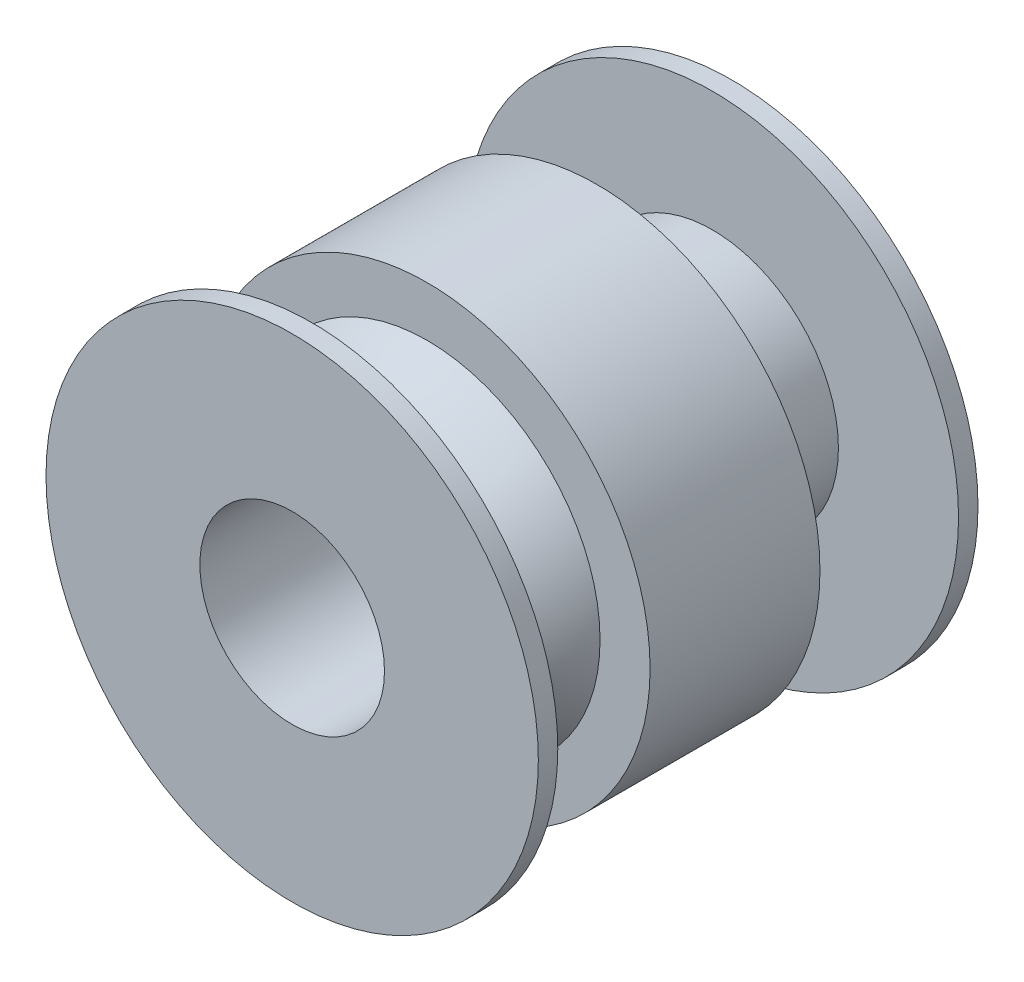
from build123d import *


with BuildPart() as part:
    # Sketch1 → Revolve1 (revolve)
    with BuildSketch(Plane(origin=(0, 0, 0), x_dir=(0, 0, -1), z_dir=(1, 0, 0)), mode=Mode.PRIVATE) as revolve1_sk:
        with BuildLine():
            Line((60.7822, -26.811732), (81.4578, -26.811732))
            Line((81.4578, -26.811732), (82.4611, -26.811732))
            Line((82.4611, -26.811732), (82.4611, -34.749232))
            Line((82.4611, -34.749232), (81.4578, -34.749232))
            Line((81.4578, -34.749232), (81.4578, -28.551632))
            Line((81.4578, -28.551632), (78.639993039, -28.551632))
            ThreePointArc((78.639993039, -28.551632), (77.1926569, -29.920339878), (75.5015, -30.973018125))
            Line((75.5015, -30.973018125), (75.5015, -33.555432))
            Line((75.5015, -33.555432), (66.7385, -33.555432))
            Line((66.7385, -33.555432), (66.7385, -30.973018125))
            ThreePointArc((66.7385, -30.973018125), (65.0473431, -29.920339878), (63.600006961, -28.551632))
            Line((63.600006961, -28.551632), (60.7822, -28.551632))
            Line((60.7822, -28.551632), (60.7822, -34.749232))
            Line((60.7822, -34.749232), (59.7789, -34.749232))
            Line((59.7789, -34.749232), (59.7789, -26.811732))
            Line((59.7789, -26.811732), (60.7822, -26.811732))
        make_face()
    revolve(revolve1_sk.sketch.rotate(Axis((0, -22.049232, -82.136173087), (0, 0, -1)), 270), axis=Axis((0, -22.049232, -82.136173087), (0, 0, -1)))


solid = part.part
